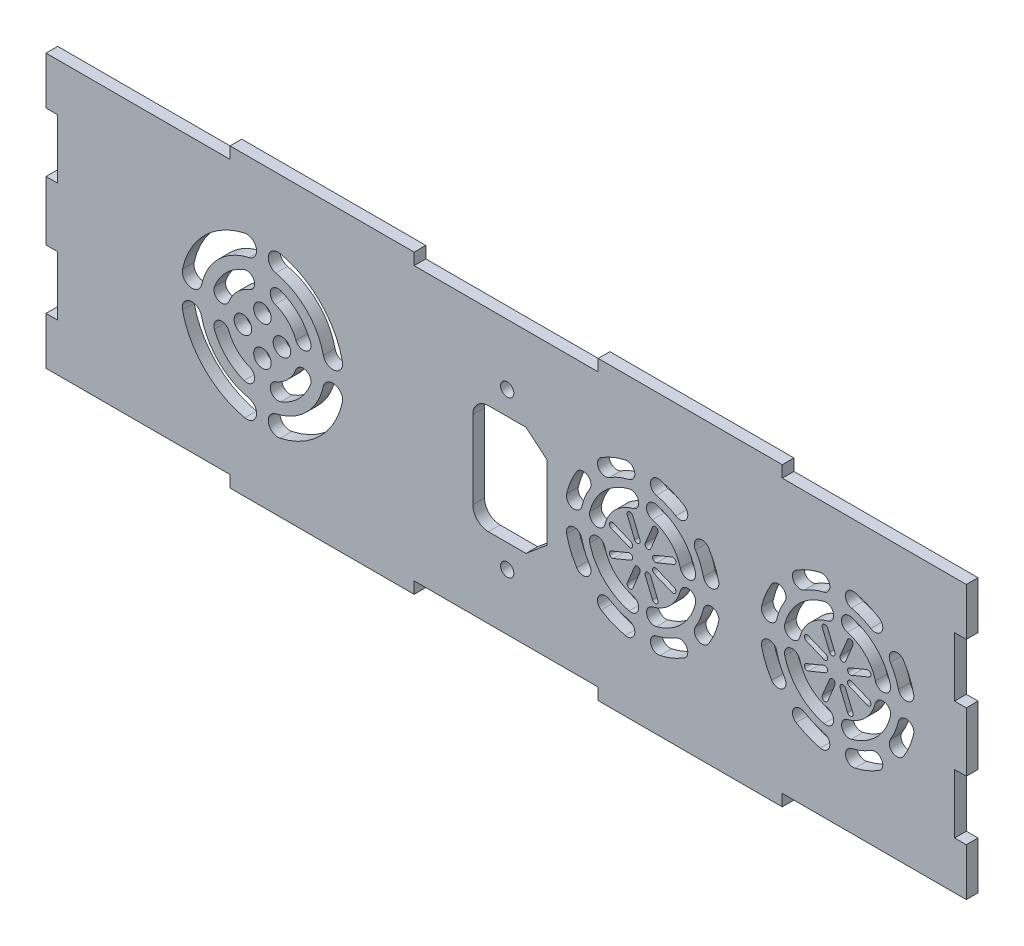
from build123d import *

# Parameters (mm, degrees)
BOSS_EXTRU_1_DEPTH                  = 3
ESQUISSE2_R                         = 2.25
ENL_V_MAT_EXTRU_3_DEPTH             = 10
ENL_V_MAT_EXTRU_4_DEPTH             = 10
DIAM_TRE_DU_PER_AGE_2_5_2_5_1_D     = 2.5
DIAM_TRE_DU_PER_AGE_2_5_2_5_1_DEPTH = 2
DIAM_TRE_DU_PER_AGE_2_5_2_5_1_TIP   = 0.751075774
ENL_V_MAT_EXTRU_6_REACH             = 139.701
ESQUISSE6_R                         = 1.7


with BuildPart() as part:
    # Esquisse1 → Boss.-Extru.1 (new body)
    with BuildSketch(Plane.XY):
        Polygon((-101.958541142, 39.199791836), (-57.758541142, 39.199791836), (-57.758541142, 42.199791836), (-10.558541142, 42.199791836), (-10.558541142, 39.199791836), (36.641458858, 39.199791836), (36.641458858, 42.199791836), (83.841458858, 42.199791836), (83.841458858, 39.199791836), (128.041458858, 39.199791836), (131.041458858, 39.199791836), (131.041458858, 26.999791836), (128.041458858, 26.999791836), (128.041458858, 11.799791836), (131.041458858, 11.799791836), (131.041458858, -3.400208164), (128.041458858, -3.400208164), (128.041458858, -18.600208164), (131.041458858, -18.600208164), (131.041458858, -30.800208164), (128.041458858, -30.800208164), (83.841458858, -30.800208164), (83.841458858, -33.800208164), (36.641458858, -33.800208164), (36.641458858, -30.800208164), (-10.558541142, -30.800208164), (-10.558541142, -33.800208164), (-57.758541142, -33.800208164), (-57.758541142, -30.800208164), (-101.958541142, -30.800208164), (-104.958541142, -30.800208164), (-104.958541142, -18.600208164), (-101.958541142, -18.600208164), (-101.958541142, -3.400208164), (-104.958541142, -3.400208164), (-104.958541142, 11.799791836), (-101.958541142, 11.799791836), (-101.958541142, 26.999791836), (-104.958541142, 26.999791836), (-104.958541142, 39.199791836), align=None)
    extrude(amount=BOSS_EXTRU_1_DEPTH)

    # Esquisse2 → Enlèv. mat.-Extru.3 (cut)
    with BuildSketch(Plane.XY.offset(3)):
        with BuildLine():
            ThreePointArc((-53.999081683, 24.70304747), (-64.307783547, 19.04903424), (-69.961796776, 8.740332376))
            ThreePointArc((-69.961796776, 8.740332376), (-68.061473551, 5.75892807), (-65.080069245, 7.659251295))
            ThreePointArc((-65.080069245, 7.659251295), (-60.772249641, 15.513500335), (-52.918000602, 19.821319938))
            ThreePointArc((-52.918000602, 19.821319938), (-51.017677376, 22.802724244), (-53.999081683, 24.70304747))
        make_face()
        with BuildLine():
            ThreePointArc((-54.173201819, 16.522813961), (-58.788195466, 13.529446159), (-61.781563268, 8.914452512))
            ThreePointArc((-61.781563268, 8.914452512), (-60.628267811, 6.331835702), (-58.045651, 7.485131159))
            ThreePointArc((-58.045651, 7.485131159), (-55.959768341, 10.701019035), (-52.743880466, 12.786901694))
            ThreePointArc((-52.743880466, 12.786901694), (-51.590585009, 15.369518504), (-54.173201819, 16.522813961))
        make_face()
        with BuildLine():
            ThreePointArc((-69.961796776, -0.340748705), (-64.307783547, -10.649450569), (-53.999081683, -16.303463799))
            ThreePointArc((-53.999081683, -16.303463799), (-51.017677376, -14.403140573), (-52.918000602, -11.421736267))
            ThreePointArc((-52.918000602, -11.421736267), (-60.772249641, -7.113916663), (-65.080069245, 0.740332376))
            ThreePointArc((-65.080069245, 0.740332376), (-68.061473551, 2.640655602), (-69.961796776, -0.340748705))
        make_face()
        with BuildLine():
            ThreePointArc((-61.781563268, -0.514868841), (-58.788195466, -5.129862488), (-54.173201819, -8.12323029))
            ThreePointArc((-54.173201819, -8.12323029), (-51.590585009, -6.969934833), (-52.743880466, -4.387318023))
            ThreePointArc((-52.743880466, -4.387318023), (-55.959768341, -2.301435363), (-58.045651, 0.914452512))
            ThreePointArc((-58.045651, 0.914452512), (-60.628267811, 2.067747969), (-61.781563268, -0.514868841))
        make_face()
        with BuildLine():
            ThreePointArc((-44.743880466, -8.12323029), (-40.128886819, -5.129862488), (-37.135519017, -0.514868841))
            ThreePointArc((-37.135519017, -0.514868841), (-38.288814474, 2.067747969), (-40.871431284, 0.914452512))
            ThreePointArc((-40.871431284, 0.914452512), (-42.957313943, -2.301435363), (-46.173201819, -4.387318023))
            ThreePointArc((-46.173201819, -4.387318023), (-47.326497276, -6.969934833), (-44.743880466, -8.12323029))
        make_face()
        with BuildLine():
            ThreePointArc((-44.918000602, -16.303463799), (-34.609298737, -10.649450569), (-28.955285508, -0.340748705))
            ThreePointArc((-28.955285508, -0.340748705), (-30.855608734, 2.640655602), (-33.83701304, 0.740332376))
            ThreePointArc((-33.83701304, 0.740332376), (-38.144832643, -7.113916663), (-45.999081683, -11.421736267))
            ThreePointArc((-45.999081683, -11.421736267), (-47.899404908, -14.403140573), (-44.918000602, -16.303463799))
        make_face()
        with BuildLine():
            ThreePointArc((-28.955285508, 8.740332376), (-34.609298737, 19.04903424), (-44.918000602, 24.70304747))
            ThreePointArc((-44.918000602, 24.70304747), (-47.899404908, 22.802724244), (-45.999081683, 19.821319938))
            ThreePointArc((-45.999081683, 19.821319938), (-38.144832643, 15.513500335), (-33.83701304, 7.659251295))
            ThreePointArc((-33.83701304, 7.659251295), (-30.855608734, 5.75892807), (-28.955285508, 8.740332376))
        make_face()
        with BuildLine():
            ThreePointArc((-40.871431284, 7.485131159), (-38.288814474, 6.331835702), (-37.135519017, 8.914452512))
            ThreePointArc((-37.135519017, 8.914452512), (-40.128886819, 13.529446159), (-44.743880466, 16.522813961))
            ThreePointArc((-44.743880466, 16.522813961), (-47.326497276, 15.369518504), (-46.173201819, 12.786901694))
            ThreePointArc((-46.173201819, 12.786901694), (-42.957313943, 10.701019035), (-40.871431284, 7.485131159))
        make_face()
        with Locations((-49.458541142, 9.199791836)):
            Circle(ESQUISSE2_R)
        with Locations((-44.458541142, 4.199791836)):
            Circle(ESQUISSE2_R)
        with Locations((-54.458541142, 4.199791836)):
            Circle(ESQUISSE2_R)
        with Locations((-49.458541142, -0.800208164)):
            Circle(ESQUISSE2_R)
    extrude(amount=-ENL_V_MAT_EXTRU_3_DEPTH, mode=Mode.SUBTRACT)

    # Esquisse3 → Enlèv. mat.-Extru.4 (cut)
    with BuildSketch(Plane.XY.offset(3)):
        with BuildLine():
            Line((51.962449617, 11.143664588), (50.098488586, 6.643664588))
            ThreePointArc((50.098488586, 6.643664588), (49.118566362, 6.237767513), (48.712669287, 7.217689737))
            Line((48.712669287, 7.217689737), (50.576630318, 11.717689737))
            ThreePointArc((50.576630318, 11.717689737), (51.556552542, 12.123586812), (51.962449617, 11.143664588))
        make_face()
        with BuildLine():
            Line((56.124247627, 6.170072428), (51.624247627, 4.306111397))
            ThreePointArc((51.624247627, 4.306111397), (50.644325403, 4.712008472), (51.050222478, 5.691930696))
            Line((51.050222478, 5.691930696), (55.550222478, 7.555891727))
            ThreePointArc((55.550222478, 7.555891727), (56.530144702, 7.149994651), (56.124247627, 6.170072428))
        make_face()
        with BuildLine():
            Line((55.550222478, -0.289623911), (51.050222478, 1.57433712))
            ThreePointArc((51.050222478, 1.57433712), (50.644325403, 2.554259344), (51.624247627, 2.960156419))
            Line((51.624247627, 2.960156419), (56.124247627, 1.096195388))
            ThreePointArc((56.124247627, 1.096195388), (56.530144702, 0.116273165), (55.550222478, -0.289623911))
        make_face()
        with BuildLine():
            Line((50.576630318, -4.451421921), (48.712669287, 0.048578079))
            ThreePointArc((48.712669287, 0.048578079), (49.118566362, 1.028500303), (50.098488586, 0.622603228))
            Line((50.098488586, 0.622603228), (51.962449617, -3.877396772))
            ThreePointArc((51.962449617, -3.877396772), (51.556552542, -4.857318996), (50.576630318, -4.451421921))
        make_face()
        with BuildLine():
            Line((44.11693398, -3.877396772), (45.98089501, 0.622603228))
            ThreePointArc((45.98089501, 0.622603228), (46.960817234, 1.028500303), (47.366714309, 0.048578079))
            Line((47.366714309, 0.048578079), (45.502753278, -4.451421921))
            ThreePointArc((45.502753278, -4.451421921), (44.522831055, -4.857318996), (44.11693398, -3.877396772))
        make_face()
        with BuildLine():
            Line((39.955135969, 1.096195388), (44.455135969, 2.960156419))
            ThreePointArc((44.455135969, 2.960156419), (45.435058193, 2.554259344), (45.029161118, 1.57433712))
            Line((45.029161118, 1.57433712), (40.529161118, -0.289623911))
            ThreePointArc((40.529161118, -0.289623911), (39.549238894, 0.116273165), (39.955135969, 1.096195388))
        make_face()
        with BuildLine():
            Line((40.529161118, 7.555891727), (45.029161118, 5.691930696))
            ThreePointArc((45.029161118, 5.691930696), (45.435058193, 4.712008472), (44.455135969, 4.306111397))
            Line((44.455135969, 4.306111397), (39.955135969, 6.170072428))
            ThreePointArc((39.955135969, 6.170072428), (39.549238894, 7.149994651), (40.529161118, 7.555891727))
        make_face()
        with BuildLine():
            Line((45.502753278, 11.717689737), (47.366714309, 7.217689737))
            ThreePointArc((47.366714309, 7.217689737), (46.960817234, 6.237767513), (45.98089501, 6.643664588))
            Line((45.98089501, 6.643664588), (44.11693398, 11.143664588))
            ThreePointArc((44.11693398, 11.143664588), (44.522831055, 12.123586812), (45.502753278, 11.717689737))
        make_face()
        with BuildLine():
            Line((101.962449617, 11.143664588), (100.098488586, 6.643664588))
            ThreePointArc((100.098488586, 6.643664588), (99.118566362, 6.237767513), (98.712669287, 7.217689737))
            Line((98.712669287, 7.217689737), (100.576630318, 11.717689737))
            ThreePointArc((100.576630318, 11.717689737), (101.556552542, 12.123586812), (101.962449617, 11.143664588))
        make_face()
        with BuildLine():
            Line((106.124247627, 6.170072428), (101.624247627, 4.306111397))
            ThreePointArc((101.624247627, 4.306111397), (100.644325403, 4.712008472), (101.050222478, 5.691930696))
            Line((101.050222478, 5.691930696), (105.550222478, 7.555891727))
            ThreePointArc((105.550222478, 7.555891727), (106.530144702, 7.149994651), (106.124247627, 6.170072428))
        make_face()
        with BuildLine():
            Line((105.550222478, -0.289623911), (101.050222478, 1.57433712))
            ThreePointArc((101.050222478, 1.57433712), (100.644325403, 2.554259344), (101.624247627, 2.960156419))
            Line((101.624247627, 2.960156419), (106.124247627, 1.096195388))
            ThreePointArc((106.124247627, 1.096195388), (106.530144702, 0.116273165), (105.550222478, -0.289623911))
        make_face()
        with BuildLine():
            Line((100.576630318, -4.451421921), (98.712669287, 0.048578079))
            ThreePointArc((98.712669287, 0.048578079), (99.118566362, 1.028500303), (100.098488586, 0.622603228))
            Line((100.098488586, 0.622603228), (101.962449617, -3.877396772))
            ThreePointArc((101.962449617, -3.877396772), (101.556552542, -4.857318996), (100.576630318, -4.451421921))
        make_face()
        with BuildLine():
            Line((94.11693398, -3.877396772), (95.98089501, 0.622603228))
            ThreePointArc((95.98089501, 0.622603228), (96.960817234, 1.028500303), (97.366714309, 0.048578079))
            Line((97.366714309, 0.048578079), (95.502753278, -4.451421921))
            ThreePointArc((95.502753278, -4.451421921), (94.522831055, -4.857318996), (94.11693398, -3.877396772))
        make_face()
        with BuildLine():
            Line((89.955135969, 1.096195388), (94.455135969, 2.960156419))
            ThreePointArc((94.455135969, 2.960156419), (95.435058193, 2.554259344), (95.029161118, 1.57433712))
            Line((95.029161118, 1.57433712), (90.529161118, -0.289623911))
            ThreePointArc((90.529161118, -0.289623911), (89.549238894, 0.116273165), (89.955135969, 1.096195388))
        make_face()
        with BuildLine():
            Line((90.529161118, 7.555891727), (95.029161118, 5.691930696))
            ThreePointArc((95.029161118, 5.691930696), (95.435058193, 4.712008472), (94.455135969, 4.306111397))
            Line((94.455135969, 4.306111397), (89.955135969, 6.170072428))
            ThreePointArc((89.955135969, 6.170072428), (89.549238894, 7.149994651), (90.529161118, 7.555891727))
        make_face()
        with BuildLine():
            Line((95.502753278, 11.717689737), (97.366714309, 7.217689737))
            ThreePointArc((97.366714309, 7.217689737), (96.960817234, 6.237767513), (95.98089501, 6.643664588))
            Line((95.98089501, 6.643664588), (94.11693398, 11.143664588))
            ThreePointArc((94.11693398, 11.143664588), (94.522831055, 12.123586812), (95.502753278, 11.717689737))
        make_face()
        with BuildLine():
            ThreePointArc((58.687288326, 20.568623046), (55.695127505, 22.114990618), (52.485903302, 23.137320828))
            ThreePointArc((52.485903302, 23.137320828), (50.091466772, 21.631773187), (51.597014413, 19.237336656))
            ThreePointArc((51.597014413, 19.237336656), (54.164393776, 18.419472488), (56.558122432, 17.18237843))
            ThreePointArc((56.558122432, 17.18237843), (59.315827687, 17.810917791), (58.687288326, 20.568623046))
        make_face()
        with BuildLine():
            ThreePointArc((67.541379719, 8.081844412), (66.519049508, 11.291068615), (64.972681936, 14.283229435))
            ThreePointArc((64.972681936, 14.283229435), (62.214976682, 14.911768796), (61.586437321, 12.154063542))
            ThreePointArc((61.586437321, 12.154063542), (62.823531378, 9.760334885), (63.641395546, 7.192955523))
            ThreePointArc((63.641395546, 7.192955523), (66.035832077, 5.687407881), (67.541379719, 8.081844412))
        make_face()
        with BuildLine():
            ThreePointArc((61.596900569, 7.137399967), (57.940953794, 13.536894904), (51.541458858, 17.192841679))
            ThreePointArc((51.541458858, 17.192841679), (49.104967185, 15.756350006), (50.541458858, 13.319858333))
            ThreePointArc((50.541458858, 13.319858333), (55.11252667, 10.708467779), (57.723917223, 6.137399967))
            ThreePointArc((57.723917223, 6.137399967), (60.160408896, 4.700908294), (61.596900569, 7.137399967))
        make_face()
        with BuildLine():
            ThreePointArc((64.972681936, -7.008429501), (66.519049508, -4.01626868), (67.541379719, -0.807044477))
            ThreePointArc((67.541379719, -0.807044477), (66.035832077, 1.587392053), (63.641395546, 0.081844412))
            ThreePointArc((63.641395546, 0.081844412), (62.823531378, -2.48553495), (61.586437321, -4.879263607))
            ThreePointArc((61.586437321, -4.879263607), (62.214976682, -7.636968862), (64.972681936, -7.008429501))
        make_face()
        with BuildLine():
            ThreePointArc((52.485903302, -15.862520894), (55.695127505, -14.840190683), (58.687288326, -13.293823111))
            ThreePointArc((58.687288326, -13.293823111), (59.315827687, -10.536117857), (56.558122432, -9.907578496))
            ThreePointArc((56.558122432, -9.907578496), (54.164393776, -11.144672553), (51.597014413, -11.962536721))
            ThreePointArc((51.597014413, -11.962536721), (50.091466772, -14.356973252), (52.485903302, -15.862520894))
        make_face()
        with BuildLine():
            ThreePointArc((108.687288326, 20.568623046), (105.695127505, 22.114990618), (102.485903302, 23.137320828))
            ThreePointArc((102.485903302, 23.137320828), (100.091466772, 21.631773187), (101.597014413, 19.237336656))
            ThreePointArc((101.597014413, 19.237336656), (104.164393776, 18.419472488), (106.558122432, 17.18237843))
            ThreePointArc((106.558122432, 17.18237843), (109.315827687, 17.810917791), (108.687288326, 20.568623046))
        make_face()
        with BuildLine():
            ThreePointArc((51.541458858, -9.918041744), (57.940953794, -6.262094969), (61.596900569, 0.137399967))
            ThreePointArc((61.596900569, 0.137399967), (60.160408896, 2.57389164), (57.723917223, 1.137399967))
            ThreePointArc((57.723917223, 1.137399967), (55.11252667, -3.433667845), (50.541458858, -6.045058398))
            ThreePointArc((50.541458858, -6.045058398), (49.104967185, -8.481550071), (51.541458858, -9.918041744))
        make_face()
        with BuildLine():
            ThreePointArc((37.39562939, -13.293823111), (40.38779021, -14.840190683), (43.597014413, -15.862520894))
            ThreePointArc((43.597014413, -15.862520894), (45.991450944, -14.356973252), (44.485903302, -11.962536721))
            ThreePointArc((44.485903302, -11.962536721), (41.91852394, -11.144672553), (39.524795283, -9.907578496))
            ThreePointArc((39.524795283, -9.907578496), (36.767090029, -10.536117857), (37.39562939, -13.293823111))
        make_face()
        with BuildLine():
            ThreePointArc((28.541537997, -0.807044477), (29.563868207, -4.01626868), (31.110235779, -7.008429501))
            ThreePointArc((31.110235779, -7.008429501), (33.867941034, -7.636968862), (34.496480395, -4.879263607))
            ThreePointArc((34.496480395, -4.879263607), (33.259386338, -2.48553495), (32.441522169, 0.081844412))
            ThreePointArc((32.441522169, 0.081844412), (30.047085638, 1.587392053), (28.541537997, -0.807044477))
        make_face()
        with BuildLine():
            ThreePointArc((34.486017146, 0.137399967), (38.141963921, -6.262094969), (44.541458858, -9.918041744))
            ThreePointArc((44.541458858, -9.918041744), (46.977950531, -8.481550071), (45.541458858, -6.045058398))
            ThreePointArc((45.541458858, -6.045058398), (40.970391046, -3.433667845), (38.359000492, 1.137399967))
            ThreePointArc((38.359000492, 1.137399967), (35.922508819, 2.57389164), (34.486017146, 0.137399967))
        make_face()
        with BuildLine():
            ThreePointArc((31.110235779, 14.283229435), (29.563868207, 11.291068615), (28.541537997, 8.081844412))
            ThreePointArc((28.541537997, 8.081844412), (30.047085638, 5.687407881), (32.441522169, 7.192955523))
            ThreePointArc((32.441522169, 7.192955523), (33.259386338, 9.760334885), (34.496480395, 12.154063542))
            ThreePointArc((34.496480395, 12.154063542), (33.867941034, 14.911768796), (31.110235779, 14.283229435))
        make_face()
        with BuildLine():
            ThreePointArc((43.597014413, 23.137320828), (40.38779021, 22.114990618), (37.39562939, 20.568623046))
            ThreePointArc((37.39562939, 20.568623046), (36.767090029, 17.810917791), (39.524795283, 17.18237843))
            ThreePointArc((39.524795283, 17.18237843), (41.91852394, 18.419472488), (44.485903302, 19.237336656))
            ThreePointArc((44.485903302, 19.237336656), (45.991450944, 21.631773187), (43.597014413, 23.137320828))
        make_face()
        with BuildLine():
            ThreePointArc((44.541458858, 17.192841679), (38.141963921, 13.536894904), (34.486017146, 7.137399967))
            ThreePointArc((34.486017146, 7.137399967), (35.922508819, 4.700908294), (38.359000492, 6.137399967))
            ThreePointArc((38.359000492, 6.137399967), (40.970391046, 10.708467779), (45.541458858, 13.319858333))
            ThreePointArc((45.541458858, 13.319858333), (46.977950531, 15.756350006), (44.541458858, 17.192841679))
        make_face()
        with BuildLine():
            ThreePointArc((117.541379719, 8.081844412), (116.519049508, 11.291068615), (114.972681936, 14.283229435))
            ThreePointArc((114.972681936, 14.283229435), (112.214976682, 14.911768796), (111.586437321, 12.154063542))
            ThreePointArc((111.586437321, 12.154063542), (112.823531378, 9.760334885), (113.641395546, 7.192955523))
            ThreePointArc((113.641395546, 7.192955523), (116.035832077, 5.687407881), (117.541379719, 8.081844412))
        make_face()
        with BuildLine():
            ThreePointArc((111.596900569, 7.137399967), (107.940953794, 13.536894904), (101.541458858, 17.192841679))
            ThreePointArc((101.541458858, 17.192841679), (99.104967185, 15.756350006), (100.541458858, 13.319858333))
            ThreePointArc((100.541458858, 13.319858333), (105.11252667, 10.708467779), (107.723917223, 6.137399967))
            ThreePointArc((107.723917223, 6.137399967), (110.160408896, 4.700908294), (111.596900569, 7.137399967))
        make_face()
        with BuildLine():
            ThreePointArc((114.972681936, -7.008429501), (116.519049508, -4.01626868), (117.541379719, -0.807044477))
            ThreePointArc((117.541379719, -0.807044477), (116.035832077, 1.587392053), (113.641395546, 0.081844412))
            ThreePointArc((113.641395546, 0.081844412), (112.823531378, -2.48553495), (111.586437321, -4.879263607))
            ThreePointArc((111.586437321, -4.879263607), (112.214976682, -7.636968862), (114.972681936, -7.008429501))
        make_face()
        with BuildLine():
            ThreePointArc((102.485903302, -15.862520894), (105.695127505, -14.840190683), (108.687288326, -13.293823111))
            ThreePointArc((108.687288326, -13.293823111), (109.315827687, -10.536117857), (106.558122432, -9.907578496))
            ThreePointArc((106.558122432, -9.907578496), (104.164393776, -11.144672553), (101.597014413, -11.962536721))
            ThreePointArc((101.597014413, -11.962536721), (100.091466772, -14.356973252), (102.485903302, -15.862520894))
        make_face()
        with BuildLine():
            ThreePointArc((101.541458858, -9.918041744), (107.940953794, -6.262094969), (111.596900569, 0.137399967))
            ThreePointArc((111.596900569, 0.137399967), (110.160408896, 2.57389164), (107.723917223, 1.137399967))
            ThreePointArc((107.723917223, 1.137399967), (105.11252667, -3.433667845), (100.541458858, -6.045058398))
            ThreePointArc((100.541458858, -6.045058398), (99.104967185, -8.481550071), (101.541458858, -9.918041744))
        make_face()
        with BuildLine():
            ThreePointArc((87.39562939, -13.293823111), (90.38779021, -14.840190683), (93.597014413, -15.862520894))
            ThreePointArc((93.597014413, -15.862520894), (95.991450944, -14.356973252), (94.485903302, -11.962536721))
            ThreePointArc((94.485903302, -11.962536721), (91.91852394, -11.144672553), (89.524795283, -9.907578496))
            ThreePointArc((89.524795283, -9.907578496), (86.767090029, -10.536117857), (87.39562939, -13.293823111))
        make_face()
        with BuildLine():
            ThreePointArc((78.541537997, -0.807044477), (79.563868207, -4.01626868), (81.110235779, -7.008429501))
            ThreePointArc((81.110235779, -7.008429501), (83.867941034, -7.636968862), (84.496480395, -4.879263607))
            ThreePointArc((84.496480395, -4.879263607), (83.259386338, -2.48553495), (82.441522169, 0.081844412))
            ThreePointArc((82.441522169, 0.081844412), (80.047085638, 1.587392053), (78.541537997, -0.807044477))
        make_face()
        with BuildLine():
            ThreePointArc((84.486017146, 0.137399967), (88.141963921, -6.262094969), (94.541458858, -9.918041744))
            ThreePointArc((94.541458858, -9.918041744), (96.977950531, -8.481550071), (95.541458858, -6.045058398))
            ThreePointArc((95.541458858, -6.045058398), (90.970391046, -3.433667845), (88.359000492, 1.137399967))
            ThreePointArc((88.359000492, 1.137399967), (85.922508819, 2.57389164), (84.486017146, 0.137399967))
        make_face()
        with BuildLine():
            ThreePointArc((81.110235779, 14.283229435), (79.563868207, 11.291068615), (78.541537997, 8.081844412))
            ThreePointArc((78.541537997, 8.081844412), (80.047085638, 5.687407881), (82.441522169, 7.192955523))
            ThreePointArc((82.441522169, 7.192955523), (83.259386338, 9.760334885), (84.496480395, 12.154063542))
            ThreePointArc((84.496480395, 12.154063542), (83.867941034, 14.911768796), (81.110235779, 14.283229435))
        make_face()
        with BuildLine():
            ThreePointArc((93.597014413, 23.137320828), (90.38779021, 22.114990618), (87.39562939, 20.568623046))
            ThreePointArc((87.39562939, 20.568623046), (86.767090029, 17.810917791), (89.524795283, 17.18237843))
            ThreePointArc((89.524795283, 17.18237843), (91.91852394, 18.419472488), (94.485903302, 19.237336656))
            ThreePointArc((94.485903302, 19.237336656), (95.991450944, 21.631773187), (93.597014413, 23.137320828))
        make_face()
        with BuildLine():
            ThreePointArc((94.541458858, 17.192841679), (88.141963921, 13.536894904), (84.486017146, 7.137399967))
            ThreePointArc((84.486017146, 7.137399967), (85.922508819, 4.700908294), (88.359000492, 6.137399967))
            ThreePointArc((88.359000492, 6.137399967), (90.970391046, 10.708467779), (95.541458858, 13.319858333))
            ThreePointArc((95.541458858, 13.319858333), (96.977950531, 15.756350006), (94.541458858, 17.192841679))
        make_face()
    extrude(amount=-ENL_V_MAT_EXTRU_4_DEPTH, mode=Mode.SUBTRACT)

    # Diamètre du perçage Ø2.5 (2.5)1
    with Locations(Plane(origin=(0, 0, 0), x_dir=(-1, 0, 0), z_dir=(0, 0, -1))):
        with Locations((-64.722555401, -12.524876278), (-64.722555401, 19.475123722), (-32.722555401, 19.475123722), (-32.722555401, -12.524876278), (-82.722555401, -12.524876278), (-82.722555401, 19.475123722), (-114.722555401, 19.475123722), (-114.722555401, -12.524876278)):
            Hole(DIAM_TRE_DU_PER_AGE_2_5_2_5_1_D / 2, depth=DIAM_TRE_DU_PER_AGE_2_5_2_5_1_DEPTH)
            with Locations((0, 0, -(DIAM_TRE_DU_PER_AGE_2_5_2_5_1_DEPTH + DIAM_TRE_DU_PER_AGE_2_5_2_5_1_TIP / 2))):  # 118° drill point
                Cone(0, DIAM_TRE_DU_PER_AGE_2_5_2_5_1_D / 2, DIAM_TRE_DU_PER_AGE_2_5_2_5_1_TIP, mode=Mode.SUBTRACT)

    # Esquisse6 → Enlèv. mat.-Extru.6 (cut, up to next)
    with BuildSketch(Plane(origin=(0, 0, 0), x_dir=(-1, 0, 0), z_dir=(0, 0, -1)), mode=Mode.PRIVATE) as enl_v_mat_extru_6_sk1:
        with Locations((-13.3100845, 23.637399967)):
            Circle(ESQUISSE6_R)
    enl_v_mat_extru_6_tool1 = extrude(enl_v_mat_extru_6_sk1.sketch, amount=-ENL_V_MAT_EXTRU_6_REACH, mode=Mode.PRIVATE) & part.part
    # Esquisse6 → Enlèv. mat.-Extru.6 (cut, up to next)
    with BuildSketch(Plane(origin=(0, 0, 0), x_dir=(-1, 0, 0), z_dir=(0, 0, -1)), mode=Mode.PRIVATE) as enl_v_mat_extru_6_sk2:
        with Locations((-13.3100845, -16.362600033)):
            Circle(ESQUISSE6_R)
    enl_v_mat_extru_6_tool2 = extrude(enl_v_mat_extru_6_sk2.sketch, amount=-ENL_V_MAT_EXTRU_6_REACH, mode=Mode.PRIVATE) & part.part
    # Esquisse6 → Enlèv. mat.-Extru.6 (cut, up to next)
    with BuildSketch(Plane(origin=(0, 0, 0), x_dir=(-1, 0, 0), z_dir=(0, 0, -1)), mode=Mode.PRIVATE) as enl_v_mat_extru_6_sk3:
        with BuildLine():
            Line((-23.491530083, -5.862600033), (-23.491530083, 13.137399967))
            Line((-23.491530083, 13.137399967), (-18.128638916, 17.637399967))
            Line((-18.128638916, 17.637399967), (-8.491530083, 17.637399967))
            ThreePointArc((-8.491530083, 17.637399967), (-5.663102958, 16.465827092), (-4.491530083, 13.637399967))
            Line((-4.491530083, 13.637399967), (-4.491530083, -6.362600033))
            ThreePointArc((-4.491530083, -6.362600033), (-5.663102958, -9.191027157), (-8.491530083, -10.362600033))
            Line((-8.491530083, -10.362600033), (-18.128638916, -10.362600033))
            Line((-18.128638916, -10.362600033), (-23.491530083, -5.862600033))
        make_face()
    enl_v_mat_extru_6_tool3 = extrude(enl_v_mat_extru_6_sk3.sketch, amount=-ENL_V_MAT_EXTRU_6_REACH, mode=Mode.PRIVATE) & part.part
    add(enl_v_mat_extru_6_tool1.solids().sort_by_distance((13.310084, 23.6374, 0))[0], mode=Mode.SUBTRACT)
    add(enl_v_mat_extru_6_tool2.solids().sort_by_distance((13.310084, -16.3626, 0))[0], mode=Mode.SUBTRACT)
    add(enl_v_mat_extru_6_tool3.solids().sort_by_distance((13.737998, 3.6374, 0))[0], mode=Mode.SUBTRACT)


solid = part.part
